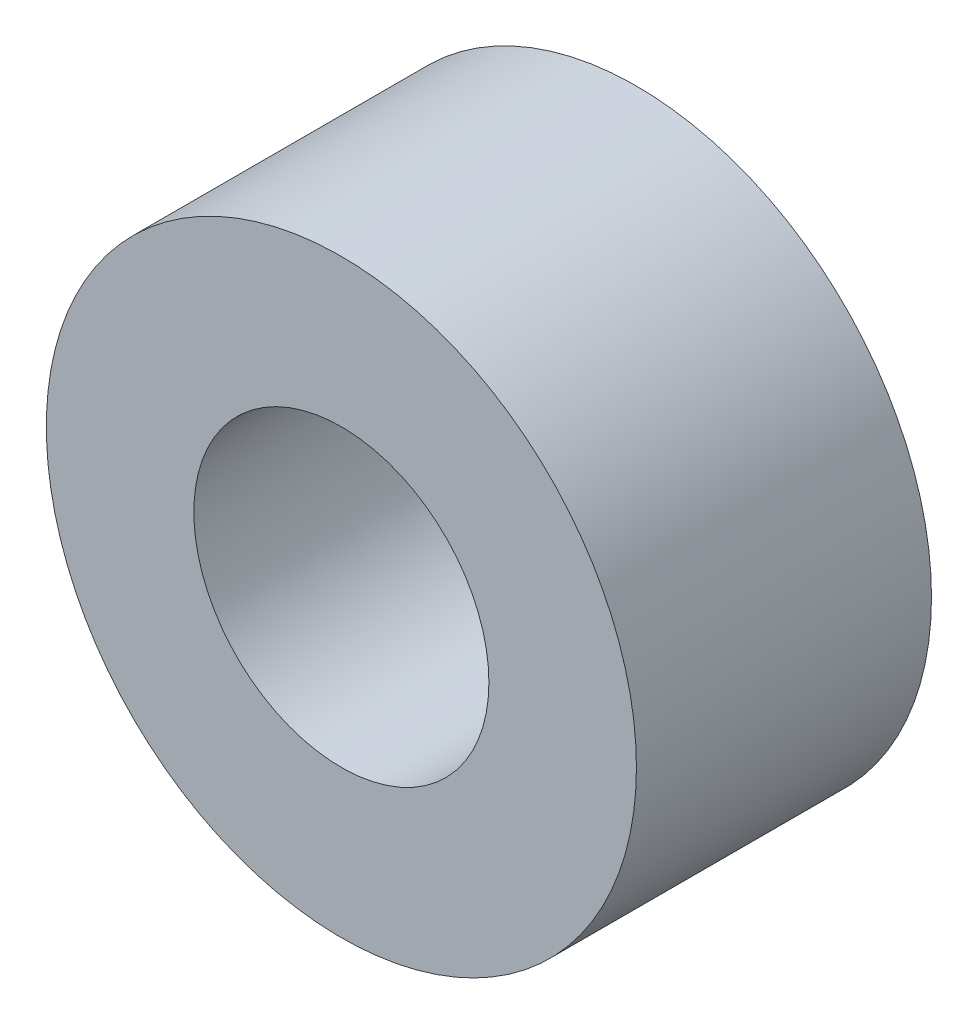
from build123d import *

# Parameters (mm, degrees)
SKETCH1_R           = 10
SKETCH1_R_2         = 5
BOSS_EXTRUDE1_DEPTH = 10


with BuildPart() as part:
    # Sketch1 → Boss-Extrude1 (new body)
    with BuildSketch(Plane.XY):
        Circle(SKETCH1_R)
        Circle(SKETCH1_R_2, mode=Mode.SUBTRACT)
    extrude(amount=BOSS_EXTRUDE1_DEPTH)


solid = part.part
